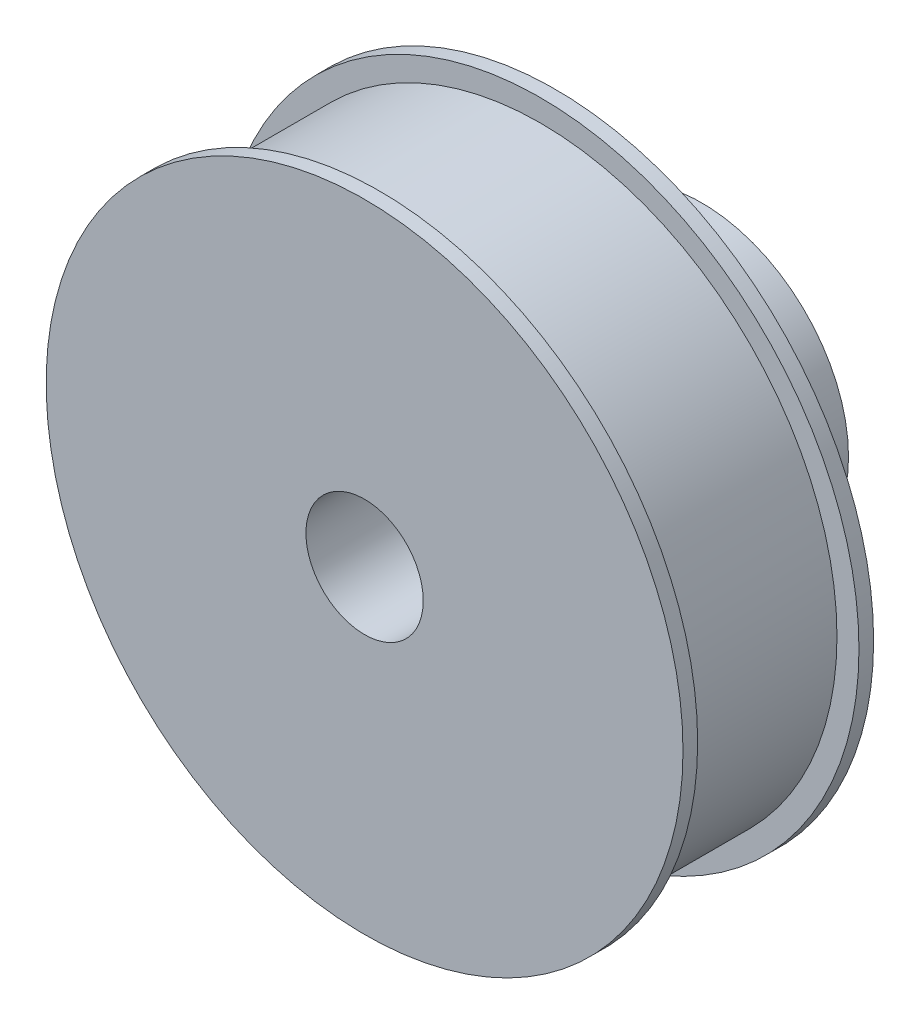
from build123d import *

# Parameters (mm, degrees)
SKETCH2_R          = 4
CUT_EXTRUDE1_DEPTH = 39.365098099
SKETCH3_R          = 1.5
CUT_EXTRUDE2_DEPTH = 39.365098099
SKETCH4_R          = 1.5
CUT_EXTRUDE3_DEPTH = 39.365098159


with BuildPart() as part:
    # Sketch1 → Revolve1 (revolve)
    with BuildSketch(Plane(origin=(0, 0, 0), x_dir=(1, 0, 0), z_dir=(0, 1, 0)), mode=Mode.PRIVATE) as revolve1_sk:
        Polygon((0, 23), (-10, 23), (-10, 13), (-21.712677773, 13), (-21.712677773, 12), (-20.212677773, 12), (-20.212677773, 1), (-21.712677773, 1), (-21.712677773, 0), (0, 0), align=None)
    revolve(revolve1_sk.sketch.rotate(Axis((0, 0, 0), (0, 0, -1)), 180), axis=Axis((0, 0, 0), (0, 0, -1)))

    # Sketch2 → Cut-Extrude1 (cut, through all)
    with BuildSketch(Plane.XY):
        Circle(SKETCH2_R)
    extrude(amount=-CUT_EXTRUDE1_DEPTH, mode=Mode.SUBTRACT)

    # Sketch3 → Cut-Extrude2 (cut, through all)
    with BuildSketch(Plane(origin=(0, 0, 0), x_dir=(1, 0, 0), z_dir=(0, 1, 0))):
        with Locations(Location((0, 18, 0), (0, 0, 270))):
            Circle(SKETCH3_R)
    extrude(amount=-CUT_EXTRUDE2_DEPTH, mode=Mode.SUBTRACT)

    # Sketch4 → Cut-Extrude3 (cut, through all)
    with BuildSketch(Plane(origin=(0, 0, 0), x_dir=(0, 0, -1), z_dir=(1, 0, 0))):
        with Locations((18, 0)):
            Circle(SKETCH4_R)
    extrude(amount=-CUT_EXTRUDE3_DEPTH, mode=Mode.SUBTRACT)


solid = part.part
